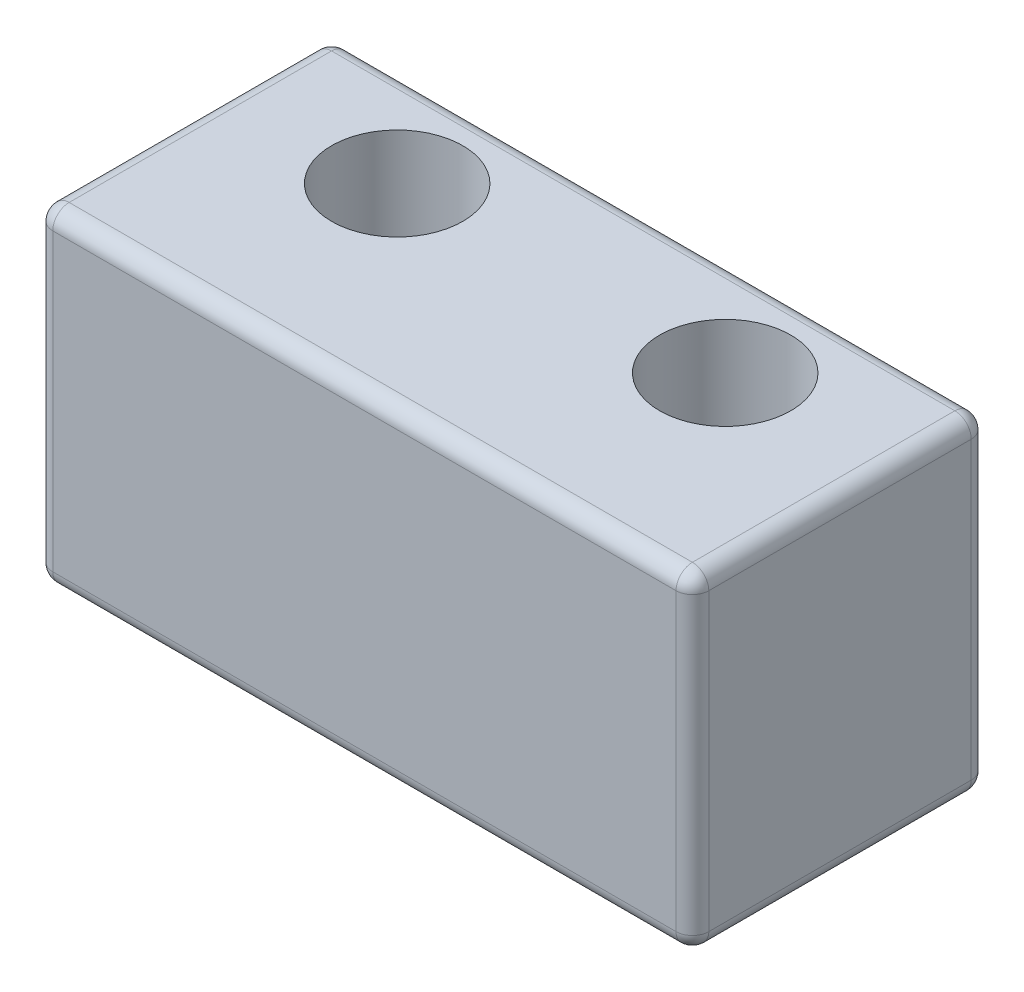
from build123d import *

# Parameters (mm, degrees)
BOSS_EXTRUDE1_DEPTH = 10
SKETCH2_R           = 2
CUT_EXTRUDE1_DEPTH  = 5
FILLET2_R           = 0.5


with BuildPart() as part:
    # Sketch1 → Boss-Extrude1 (new body)
    with BuildSketch(Plane(origin=(0, 0, 0), x_dir=(1, 0, 0), z_dir=(0, 1, 0))):
        Polygon((-9.137931034, 3.146551724), (10.862068966, 3.146551724), (10.862068966, -1.853448276), (10.862068966, -5.853448276), (-9.137931034, -5.853448276), (-9.137931034, -1.853448276), align=None)
    extrude(amount=BOSS_EXTRUDE1_DEPTH)

    # Sketch2 → Cut-Extrude1 (cut)
    with BuildSketch(Plane(origin=(0, 10, 0), x_dir=(1, 0, 0), z_dir=(0, 1, 0))):
        with Locations(Location((-4.137931034, 0.146551724, 0), (0, 0, 270))):
            Circle(SKETCH2_R)
        with Locations(Location((5.862068966, 0.146551724, 0), (0, 0, 270))):
            Circle(SKETCH2_R)
    extrude(amount=-CUT_EXTRUDE1_DEPTH, mode=Mode.SUBTRACT)

    # Fillet2
    fillet2_edges = [part.edges().sort_by_distance(p)[0] for p in [
        (-9.137931034, 5, -3.146551724),
        (10.862068966, 5, -3.146551724),
        (10.862068966, 5, 5.853448276),
        (-9.137931034, 5, 5.853448276),
        (0.862068966, 10, 5.853448276),
        (10.862068966, 10, 1.353448276),
        (0.862068966, 10, -3.146551724),
        (-9.137931034, 10, 1.353448276),
        (0.862068966, 0, -3.146551724),
        (10.862068966, 0, 1.353448276),
        (0.862068966, 0, 5.853448276),
        (-9.137931034, 0, 1.353448276),
    ]]
    fillet(fillet2_edges, radius=FILLET2_R)


solid = part.part
